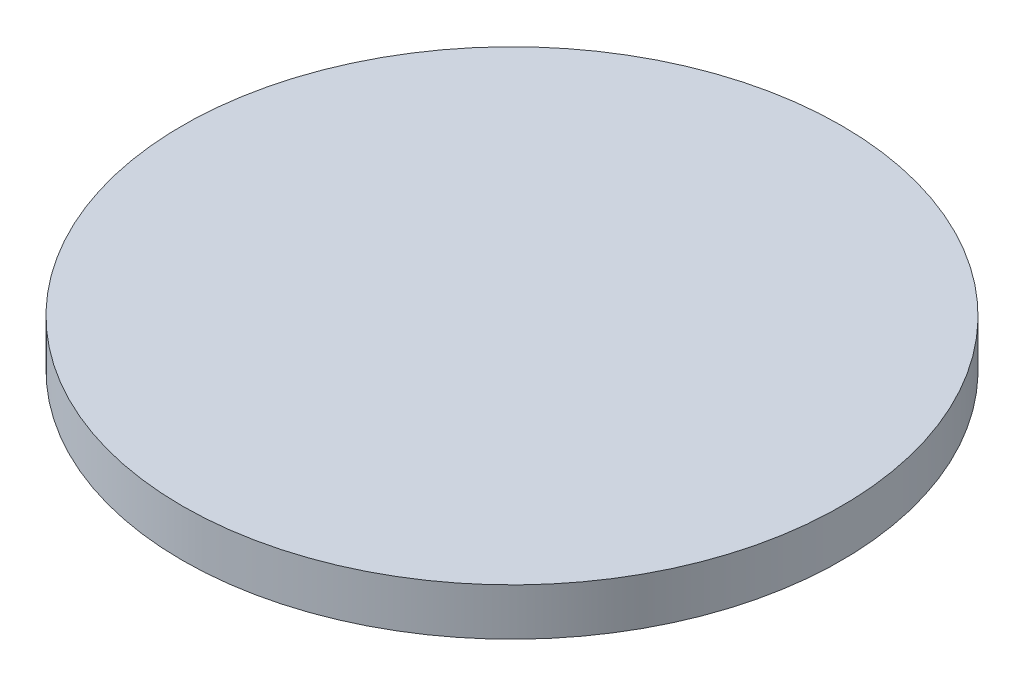
from build123d import *

# Parameters (mm, degrees)
SKETCH1_R           = 44.45
BOSS_EXTRUDE1_DEPTH = 6.35


with BuildPart() as part:
    # Sketch1 → Boss-Extrude1 (new body)
    with BuildSketch(Plane(origin=(0, 0, 0), x_dir=(1, 0, 0), z_dir=(0, 1, 0))):
        with Locations(Location((0, 0, 0), (0, 0, 270))):
            Circle(SKETCH1_R)
    extrude(amount=BOSS_EXTRUDE1_DEPTH)


solid = part.part
